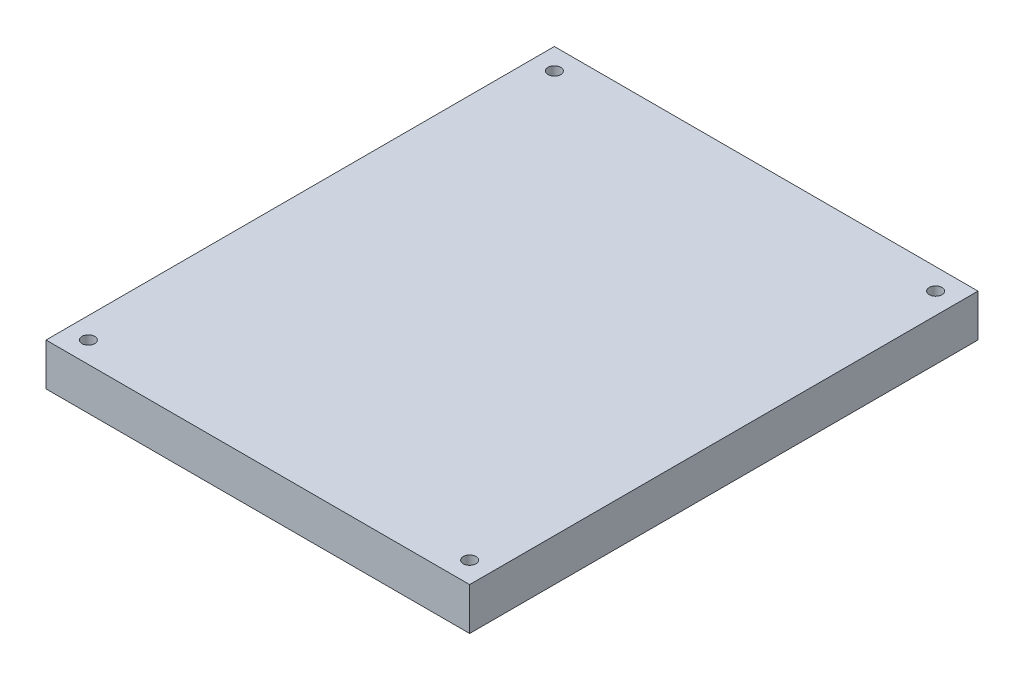
from build123d import *

# Parameters (mm, degrees)
SKETCH1_W           = 100
SKETCH1_H           = 120
BOSS_EXTRUDE1_DEPTH = 10
SKETCH2_R           = 1.5
CUT_EXTRUDE4_DEPTH  = 151.12456709


with BuildPart() as part:
    # Sketch1 → Boss-Extrude1 (new body)
    with BuildSketch(Plane(origin=(0, 0, 0), x_dir=(1, 0, 0), z_dir=(0, 1, 0))):
        with Locations((45.566502463, -55.344827586)):
            Rectangle(SKETCH1_W, SKETCH1_H)
    extrude(amount=BOSS_EXTRUDE1_DEPTH)

    # Sketch2 → Cut-Extrude4 (cut, through all)
    with BuildSketch(Plane(origin=(0, 10, 0), x_dir=(1, 0, 0), z_dir=(0, 1, 0))):
        with Locations(Location((0.566502463, -0.344827586, 0), (0, 0, 270))):
            Circle(SKETCH2_R)
        with Locations(Location((90.566502463, -0.344827586, 0), (0, 0, 90))):
            Circle(SKETCH2_R)
        with Locations(Location((90.566502463, -110.344827586, 0), (0, 0, 270))):
            Circle(SKETCH2_R)
        with Locations(Location((0.566502463, -110.344827586, 0), (0, 0, 90))):
            Circle(SKETCH2_R)
    extrude(amount=-CUT_EXTRUDE4_DEPTH, mode=Mode.SUBTRACT)


solid = part.part
